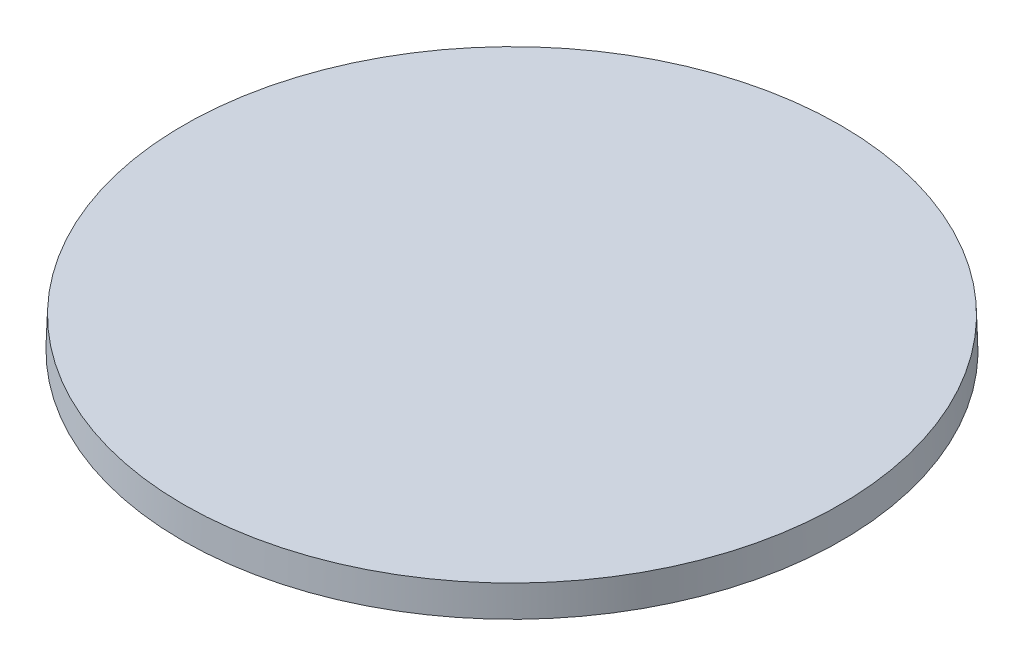
from build123d import *

# Parameters (mm, degrees)
SKETCH1_R           = 16.12
BOSS_EXTRUDE1_DEPTH = 1.5
BOSS_EXTRUDE1_TAPER = 2


with BuildPart() as part:
    # Sketch1 → Boss-Extrude1 (new body)
    with BuildSketch(Plane(origin=(0, 0, 0), x_dir=(1, 0, 0), z_dir=(0, 1, 0))):
        Circle(SKETCH1_R)
    extrude(amount=BOSS_EXTRUDE1_DEPTH, taper=BOSS_EXTRUDE1_TAPER)


solid = part.part
